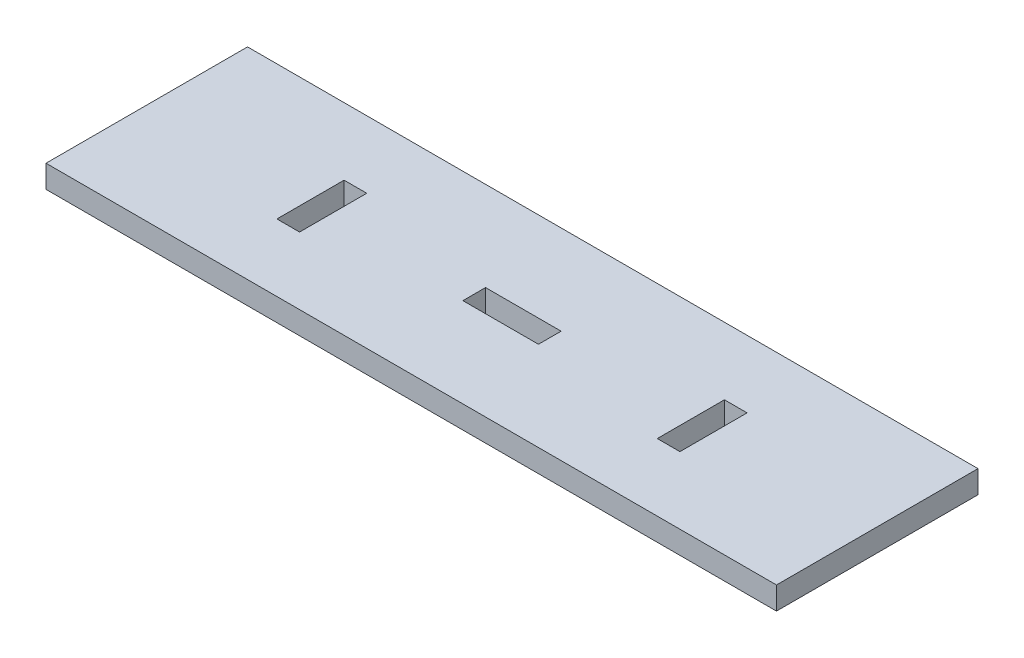
from build123d import *

# Parameters (mm, degrees)
SKETCH1_W           = 30
SKETCH1_H           = 9
SKETCH1_W_2         = 9
SKETCH1_H_2         = 26.666666667
BOSS_EXTRUDE1_DEPTH = 9


with BuildPart() as part:
    # Sketch1 → Boss-Extrude1 (new body)
    # profile 1 of 7: a face of its own
    with BuildSketch(Plane(origin=(0, 0, 0), x_dir=(1, 0, 0), z_dir=(0, 1, 0))):
        Polygon((74, 26.666666667), (74, 0), (216, 0), (216, 26.666666667), (216, 53.333333333), (216, 80), (74, 80), (74, 53.333333333), align=None)
        with Locations((145, 40)):
            Rectangle(SKETCH1_W, SKETCH1_H, mode=Mode.SUBTRACT)
    # profile 2 of 7: a face of its own
    with BuildSketch(Plane(origin=(0, 0, 0), x_dir=(1, 0, 0), z_dir=(0, 1, 0))):
        with Locations((69.5, 66.666666667)):
            Rectangle(SKETCH1_W_2, SKETCH1_H_2)
    # profile 3 of 7: a face of its own
    with BuildSketch(Plane(origin=(0, 0, 0), x_dir=(1, 0, 0), z_dir=(0, 1, 0))):
        with Locations((69.5, 13.333333334)):
            Rectangle(SKETCH1_W_2, SKETCH1_H_2)
    # profile 4 of 7: a face of its own
    with BuildSketch(Plane(origin=(0, 0, 0), x_dir=(1, 0, 0), z_dir=(0, 1, 0))):
        Polygon((0, 80), (0, 0), (65, 0), (65, 26.666666667), (65, 53.333333333), (65, 80), align=None)
    # profile 5 of 7: a face of its own
    with BuildSketch(Plane(origin=(0, 0, 0), x_dir=(1, 0, 0), z_dir=(0, 1, 0))):
        Polygon((225, 26.666666667), (225, 0), (290, 0), (290, 80), (225, 80), (225, 53.333333333), align=None)
    # profile 6 of 7: a face of its own
    with BuildSketch(Plane(origin=(0, 0, 0), x_dir=(1, 0, 0), z_dir=(0, 1, 0))):
        with Locations((220.5, 13.333333334)):
            Rectangle(SKETCH1_W_2, SKETCH1_H_2)
    # profile 7 of 7: a face of its own
    with BuildSketch(Plane(origin=(0, 0, 0), x_dir=(1, 0, 0), z_dir=(0, 1, 0))):
        with Locations((220.5, 66.666666667)):
            Rectangle(SKETCH1_W_2, SKETCH1_H_2)
    extrude(amount=BOSS_EXTRUDE1_DEPTH)


solid = part.part
